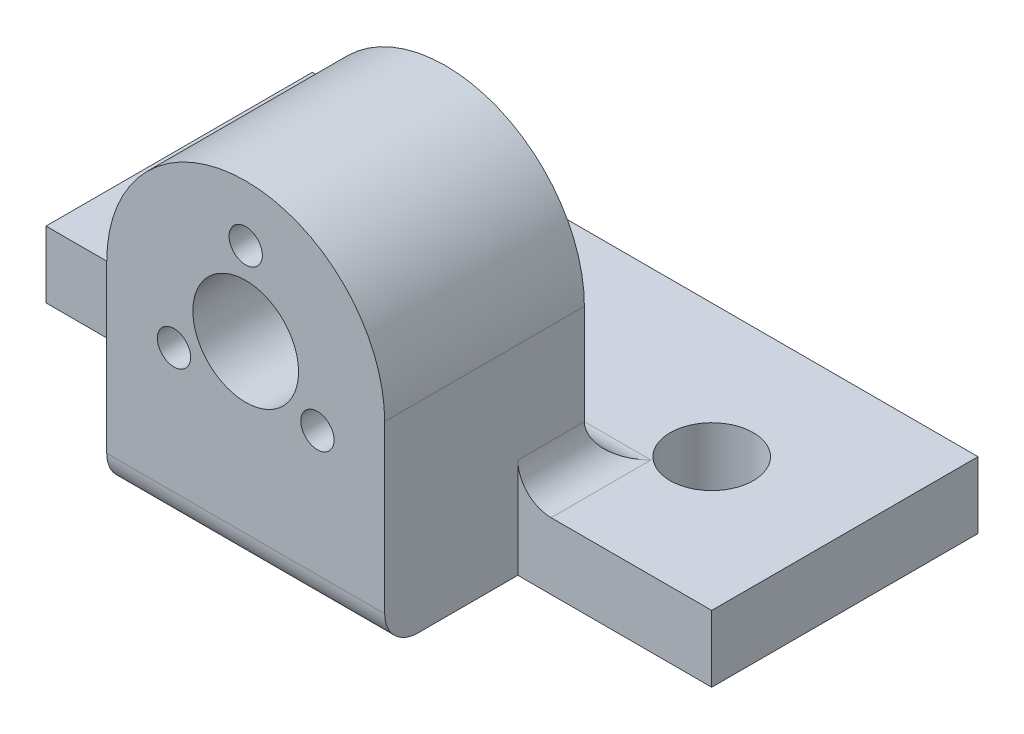
from build123d import *

# Parameters (mm, degrees)
SKETCH1_W                = 20
SKETCH1_H                = 8
SKETCH1_R                = 1.25
BOSS_EXTRUDE1_DEPTH      = 2
BOSS_EXTRUDE2_DEPTH      = 4
BOSS_EXTRUDE2_DEPTH_BACK = 2
SKETCH3_R                = 0.5
SKETCH3_R_2              = 1
SKETCH5_R                = 1.5875
CUT_EXTRUDE1_DEPTH       = 4
FILLET1_R                = 1


with BuildPart() as part:
    # Sketch1 → Boss-Extrude1 (new body)
    with BuildSketch(Plane(origin=(0, 0, 0), x_dir=(1, 0, 0), z_dir=(0, 1, 0))):
        with Locations((10, 4)):
            Rectangle(SKETCH1_W, SKETCH1_H)
        with Locations(Location((4, 4, 0), (0, 0, 270))):
            Circle(SKETCH1_R, mode=Mode.SUBTRACT)
        with Locations(Location((16, 4, 0), (0, 0, 270))):
            Circle(SKETCH1_R, mode=Mode.SUBTRACT)
    extrude(amount=BOSS_EXTRUDE1_DEPTH)

    # Sketch3 → Boss-Extrude2 (add, two sides: drawn at the far end of the back side and taken through both)
    with BuildSketch(Plane.XY.offset(-BOSS_EXTRUDE2_DEPTH_BACK)):
        with BuildLine():
            Line((5.825, 2), (5.825, 6))
            ThreePointArc((5.825, 6), (10, 10.175), (14.175, 6))
            Line((14.175, 6), (14.175, 2))
            Line((14.175, 2), (14.175, 0))
            Line((14.175, 0), (5.825, 0))
            Line((5.825, 0), (5.825, 2))
        make_face()
        with Locations((10, 8.4875)):
            Circle(SKETCH3_R, mode=Mode.SUBTRACT)
        with Locations((12.154238192, 4.75625)):
            Circle(SKETCH3_R, mode=Mode.SUBTRACT)
        with Locations((7.845761808, 4.75625)):
            Circle(SKETCH3_R, mode=Mode.SUBTRACT)
        with Locations((10, 6)):
            Circle(SKETCH3_R_2, mode=Mode.SUBTRACT)
    extrude(amount=BOSS_EXTRUDE2_DEPTH + BOSS_EXTRUDE2_DEPTH_BACK)

    # Sketch5 → Cut-Extrude1 (cut)
    with BuildSketch(Plane.XY.offset(4)):
        with Locations((10, 6)):
            Circle(SKETCH5_R)
    extrude(amount=-CUT_EXTRUDE1_DEPTH, mode=Mode.SUBTRACT)

    # Fillet1
    fillet1_edges = [part.edges().sort_by_distance(p)[0] for p in [
        (10, 2, -2),
        (14.175, 2, -1),
        (5.825, 2, -1),
        (10, 0, 4),
    ]]
    fillet(fillet1_edges, radius=FILLET1_R)


solid = part.part
